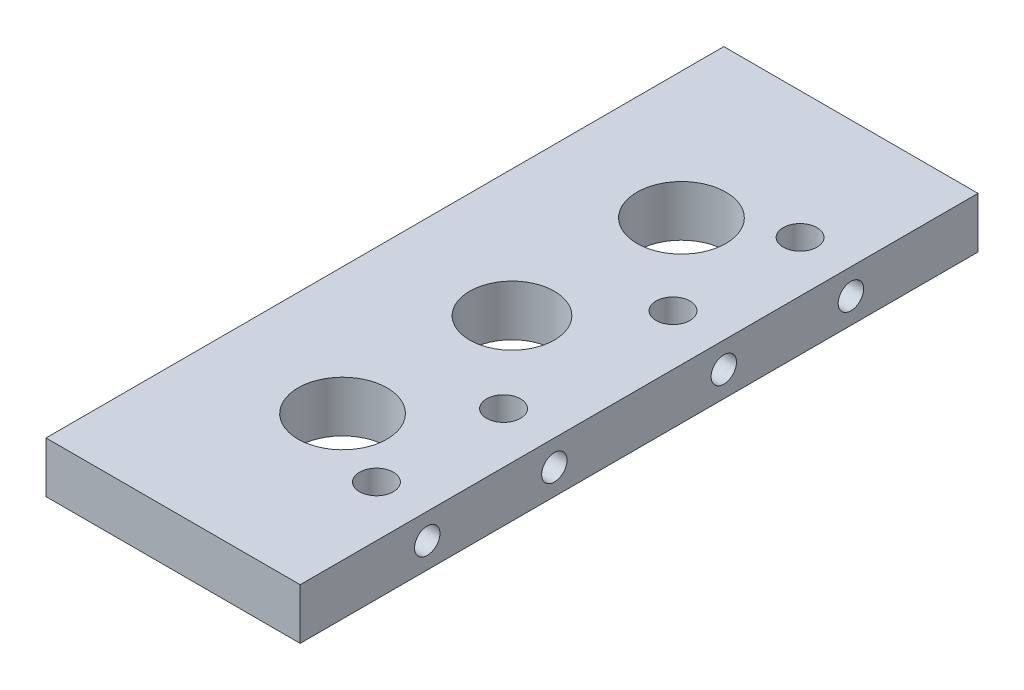
from build123d import *

# Parameters (mm, degrees)
SKETCH1_W           = 60
SKETCH1_H           = 160
SKETCH1_R           = 10
SKETCH1_R_2         = 10.5
BOSS_EXTRUDE1_DEPTH = 12
CUT_EXTRUDE1_REACH  = 88.279
SKETCH2_R           = 4
CUT_EXTRUDE2_REACH  = 102.717
SKETCH3_R           = 3


with BuildPart() as part:
    # Sketch1 → Boss-Extrude1 (new body)
    with BuildSketch(Plane(origin=(0, 0, 0), x_dir=(1, 0, 0), z_dir=(0, 1, 0))):
        Rectangle(SKETCH1_W, SKETCH1_H)
        with Locations(Location((0, 0, 0), (0, 0, 270))):
            Circle(SKETCH1_R, mode=Mode.SUBTRACT)
        with Locations(Location((0, 40, 0), (0, 0, 270))):
            Circle(SKETCH1_R_2, mode=Mode.SUBTRACT)
        with Locations(Location((0, -40, 0), (0, 0, 270))):
            Circle(SKETCH1_R_2, mode=Mode.SUBTRACT)
    extrude(amount=BOSS_EXTRUDE1_DEPTH)

    # Sketch2 → Cut-Extrude1 (cut, up to next)
    with BuildSketch(Plane(origin=(0, 12, 0), x_dir=(1, 0, 0), z_dir=(0, 1, 0)), mode=Mode.PRIVATE) as cut_extrude1_sk1:
        with Locations(Location((18, 50, 0), (0, 0, 270))):
            Circle(SKETCH2_R)
    cut_extrude1_tool1 = extrude(cut_extrude1_sk1.sketch, amount=-CUT_EXTRUDE1_REACH, mode=Mode.PRIVATE) & part.part
    # Sketch2 → Cut-Extrude1 (cut, up to next)
    with BuildSketch(Plane(origin=(0, 12, 0), x_dir=(1, 0, 0), z_dir=(0, 1, 0)), mode=Mode.PRIVATE) as cut_extrude1_sk2:
        with Locations(Location((18, -50, 0), (0, 0, 270))):
            Circle(SKETCH2_R)
    cut_extrude1_tool2 = extrude(cut_extrude1_sk2.sketch, amount=-CUT_EXTRUDE1_REACH, mode=Mode.PRIVATE) & part.part
    # Sketch2 → Cut-Extrude1 (cut, up to next)
    with BuildSketch(Plane(origin=(0, 12, 0), x_dir=(1, 0, 0), z_dir=(0, 1, 0)), mode=Mode.PRIVATE) as cut_extrude1_sk3:
        with Locations(Location((18, -20, 0), (0, 0, 270))):
            Circle(SKETCH2_R)
    cut_extrude1_tool3 = extrude(cut_extrude1_sk3.sketch, amount=-CUT_EXTRUDE1_REACH, mode=Mode.PRIVATE) & part.part
    # Sketch2 → Cut-Extrude1 (cut, up to next)
    with BuildSketch(Plane(origin=(0, 12, 0), x_dir=(1, 0, 0), z_dir=(0, 1, 0)), mode=Mode.PRIVATE) as cut_extrude1_sk4:
        with Locations(Location((18, 20, 0), (0, 0, 270))):
            Circle(SKETCH2_R)
    cut_extrude1_tool4 = extrude(cut_extrude1_sk4.sketch, amount=-CUT_EXTRUDE1_REACH, mode=Mode.PRIVATE) & part.part
    add(cut_extrude1_tool1.solids().sort_by_distance((18, 12, -50))[0], mode=Mode.SUBTRACT)
    add(cut_extrude1_tool2.solids().sort_by_distance((18, 12, 50))[0], mode=Mode.SUBTRACT)
    add(cut_extrude1_tool3.solids().sort_by_distance((18, 12, 20))[0], mode=Mode.SUBTRACT)
    add(cut_extrude1_tool4.solids().sort_by_distance((18, 12, -20))[0], mode=Mode.SUBTRACT)

    # Sketch3 → Cut-Extrude2 (cut, up to next)
    with BuildSketch(Plane(origin=(30, 0, 0), x_dir=(0, 0, -1), z_dir=(1, 0, 0)), mode=Mode.PRIVATE) as cut_extrude2_sk1:
        with Locations((50, 6)):
            Circle(SKETCH3_R)
    cut_extrude2_tool1 = extrude(cut_extrude2_sk1.sketch, amount=-CUT_EXTRUDE2_REACH, mode=Mode.PRIVATE) & part.part
    # Sketch3 → Cut-Extrude2 (cut, up to next)
    with BuildSketch(Plane(origin=(30, 0, 0), x_dir=(0, 0, -1), z_dir=(1, 0, 0)), mode=Mode.PRIVATE) as cut_extrude2_sk2:
        with Locations((20, 6)):
            Circle(SKETCH3_R)
    cut_extrude2_tool2 = extrude(cut_extrude2_sk2.sketch, amount=-CUT_EXTRUDE2_REACH, mode=Mode.PRIVATE) & part.part
    # Sketch3 → Cut-Extrude2 (cut, up to next)
    with BuildSketch(Plane(origin=(30, 0, 0), x_dir=(0, 0, -1), z_dir=(1, 0, 0)), mode=Mode.PRIVATE) as cut_extrude2_sk3:
        with Locations((-20, 6)):
            Circle(SKETCH3_R)
    cut_extrude2_tool3 = extrude(cut_extrude2_sk3.sketch, amount=-CUT_EXTRUDE2_REACH, mode=Mode.PRIVATE) & part.part
    # Sketch3 → Cut-Extrude2 (cut, up to next)
    with BuildSketch(Plane(origin=(30, 0, 0), x_dir=(0, 0, -1), z_dir=(1, 0, 0)), mode=Mode.PRIVATE) as cut_extrude2_sk4:
        with Locations((-50, 6)):
            Circle(SKETCH3_R)
    cut_extrude2_tool4 = extrude(cut_extrude2_sk4.sketch, amount=-CUT_EXTRUDE2_REACH, mode=Mode.PRIVATE) & part.part
    add(cut_extrude2_tool1.solids().sort_by_distance((30, 6, -50))[0], mode=Mode.SUBTRACT)
    add(cut_extrude2_tool2.solids().sort_by_distance((30, 6, -20))[0], mode=Mode.SUBTRACT)
    add(cut_extrude2_tool3.solids().sort_by_distance((30, 6, 20))[0], mode=Mode.SUBTRACT)
    add(cut_extrude2_tool4.solids().sort_by_distance((30, 6, 50))[0], mode=Mode.SUBTRACT)


solid = part.part
